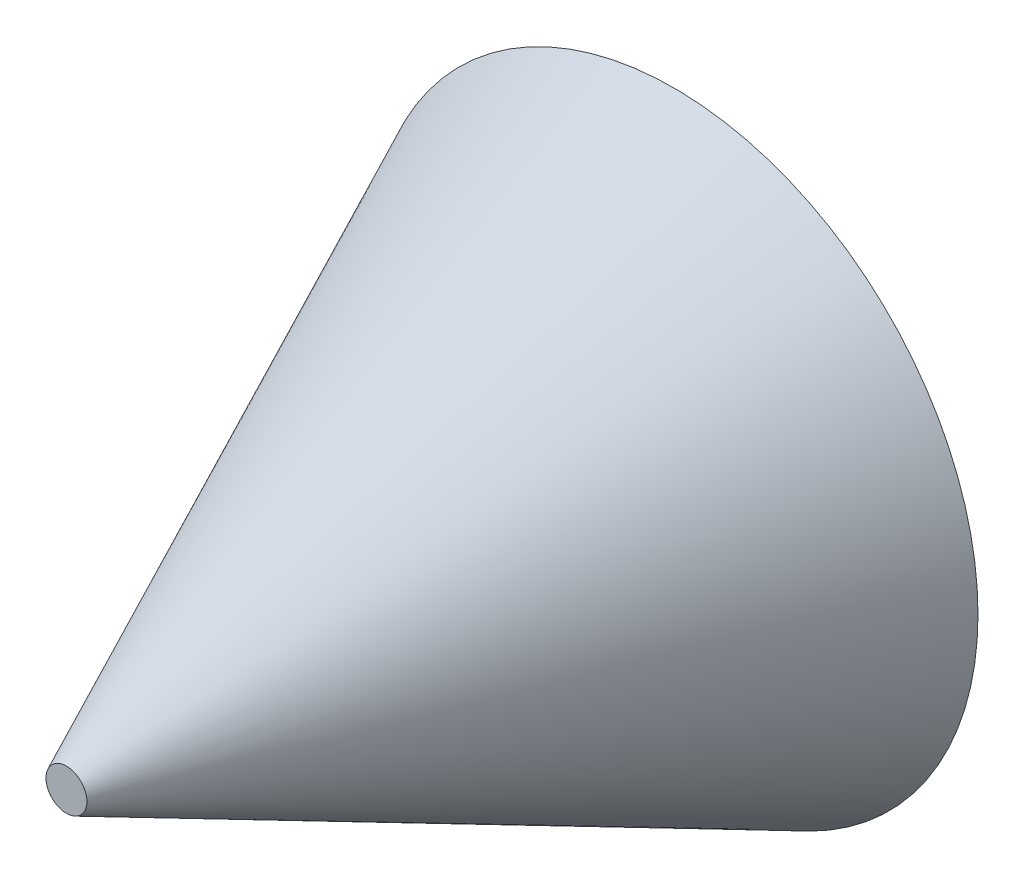
from build123d import *

# Parameters (mm, degrees)
SKETCH1_R           = 12.5
BOSS_EXTRUDE1_DEPTH = 25
BOSS_EXTRUDE1_TAPER = 25


with BuildPart() as part:
    # Sketch1 → Boss-Extrude1 (new body)
    with BuildSketch(Plane.XY):
        Circle(SKETCH1_R)
    extrude(amount=BOSS_EXTRUDE1_DEPTH, taper=BOSS_EXTRUDE1_TAPER)


solid = part.part
